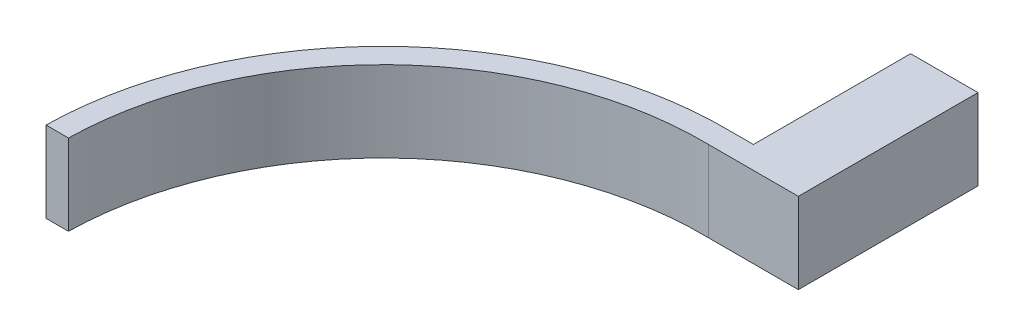
from build123d import *

# Parameters (mm, degrees)
BOSS_EXTRUDE1_DEPTH = 18
CUT_EXTRUDE1_DEPTH  = 4


with BuildPart() as part:
    # Sketch1 → Boss-Extrude1 (new body)
    with BuildSketch(Plane(origin=(0, 0, 0), x_dir=(1, 0, 0), z_dir=(0, 1, 0))):
        with BuildLine():
            Line((47.5, 30), (57.5, 30))
            Line((57.5, 30), (57.5, 70))
            Line((57.5, 70), (42.5, 70))
            Line((42.5, 70), (42.5, 35))
            Line((42.5, 35), (37.5, 35))
            ThreePointArc((37.5, 35), (-16.783008589, 13.550775542), (-40, -40))
            Line((-40, -40), (-35, -40))
            ThreePointArc((-35, -40), (-13.247474683, 10.015241636), (37.5, 30))
            Line((37.5, 30), (47.5, 30))
        make_face()
    extrude(amount=BOSS_EXTRUDE1_DEPTH)

    # Sketch4 → Cut-Extrude1 (cut)
    with BuildSketch(Plane(origin=(0, 0, 0), x_dir=(-1, 0, 0), z_dir=(0, -1, 0))):
        Polygon((-50, 70), (-45, 70), (-45, 40), (-55, 40), (-55, 70), align=None)
    extrude(amount=-CUT_EXTRUDE1_DEPTH, mode=Mode.SUBTRACT)


solid = part.part
